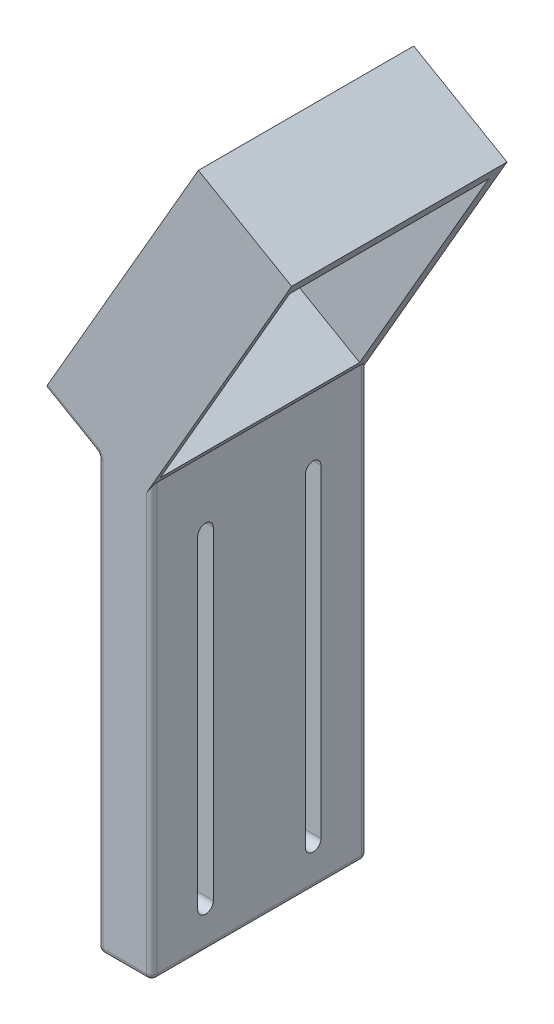
from build123d import *

# Parameters (mm, degrees)
BOSS_EXTRU_1_DEPTH      = 40
CONG_2_R                = 1
ENL_V_MAT_EXTRU_4_REACH = 147.362
ESQUISSE14_W            = 37
ESQUISSE14_H            = 48
ENL_V_MAT_EXTRU_5_DEPTH = 20


with BuildPart() as part:
    # Esquisse1 → Boss.-Extru.1 (new body)
    with BuildSketch(Plane.XY):
        Polygon((0, 0), (10, 0), (10, 80), (36, 125.033320997), (18.679491924, 135.033320997), (-9.820508076, 85.669872981), (0, 80), align=None)
    extrude(amount=BOSS_EXTRU_1_DEPTH)

    # Congé2
    cong_2_edges = [part.edges().sort_by_distance(p)[0] for p in [
        (0, 40, 0),
        (0, 80, 20),
        (10, 40, 40),
        (10, 0, 20),
        (0, 0, 20),
        (-4.910254038, 82.834936491, 40),
        (0, 40, 40),
        (-4.910254038, 82.834936491, 0),
        (5, 0, 40),
        (10, 40, 0),
        (5, 0, 0),
    ]]
    fillet(cong_2_edges, radius=CONG_2_R)

    # Esquisse13 → Enlèv. mat.-Extru.4 (cut, up to next)
    with BuildSketch(Plane.ZY, mode=Mode.PRIVATE) as enl_v_mat_extru_4_sk1:
        with BuildLine():
            Line((8.55, 7.5), (8.55, 67.5))
            ThreePointArc((8.55, 67.5), (10, 68.95), (11.45, 67.5))
            Line((11.45, 67.5), (11.45, 7.5))
            ThreePointArc((11.45, 7.5), (10, 6.05), (8.55, 7.5))
        make_face()
    enl_v_mat_extru_4_tool1 = extrude(enl_v_mat_extru_4_sk1.sketch, amount=-ENL_V_MAT_EXTRU_4_REACH, mode=Mode.PRIVATE) & part.part
    # Esquisse13 → Enlèv. mat.-Extru.4 (cut, up to next)
    with BuildSketch(Plane.ZY, mode=Mode.PRIVATE) as enl_v_mat_extru_4_sk2:
        with BuildLine():
            Line((28.55, 7.5), (28.55, 67.5))
            ThreePointArc((28.55, 67.5), (30, 68.95), (31.45, 67.5))
            Line((31.45, 67.5), (31.45, 7.5))
            ThreePointArc((31.45, 7.5), (30, 6.05), (28.55, 7.5))
        make_face()
    enl_v_mat_extru_4_tool2 = extrude(enl_v_mat_extru_4_sk2.sketch, amount=-ENL_V_MAT_EXTRU_4_REACH, mode=Mode.PRIVATE) & part.part
    add(enl_v_mat_extru_4_tool1.solids().sort_by_distance((0, 37.5, 10))[0], mode=Mode.SUBTRACT)
    add(enl_v_mat_extru_4_tool2.solids().sort_by_distance((0, 37.5, 30))[0], mode=Mode.SUBTRACT)

    # Esquisse14 → Enlèv. mat.-Extru.5 (cut)
    with BuildSketch(Plane(origin=(-44.461524227, 25.669872981, 0), x_dir=(0, 0, 1), z_dir=(-0.8660254037844419, 0.4999999999999945, 0))):
        with Locations((20.5, 99.55560496)):
            Rectangle(ESQUISSE14_W, ESQUISSE14_H)
    extrude(amount=-ENL_V_MAT_EXTRU_5_DEPTH, mode=Mode.SUBTRACT)


solid = part.part
